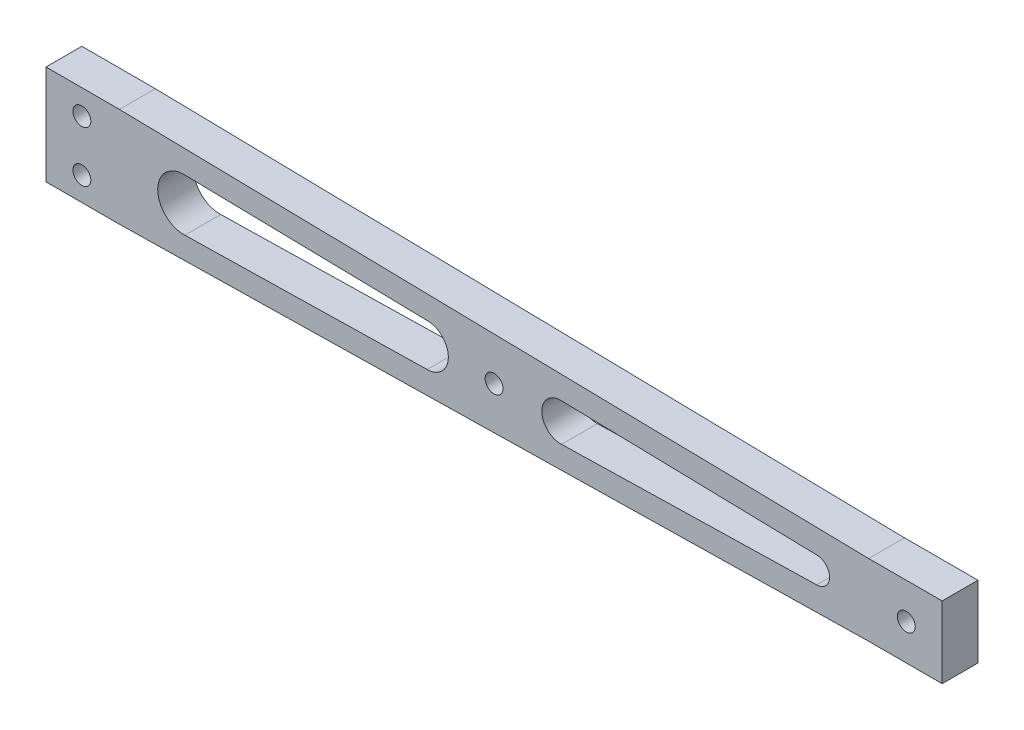
from build123d import *

# Parameters (mm, degrees)
MODEL_R                     = 2.5
DODANIE_WYCI_GNI_CIE1_DEPTH = 10


with BuildPart() as part:
    # Model → Dodanie-wyciągnięcie1 (new body)
    with BuildSketch(Plane.XY):
        Polygon((229.573669216, 20), (20.573669216, 24), (0.073669216, 24), (0.073669216, -3.757619404), (20.573669216, -3.757619404), (229.573669216, 0), (250.073669216, 0), (250.073669216, 20), align=None)
        with Locations((10.073669216, 17.121190298)):
            Circle(MODEL_R, mode=Mode.SUBTRACT)
        with Locations((240.073669216, 10)):
            Circle(MODEL_R, mode=Mode.SUBTRACT)
        with Locations((10.073669216, 2.878809702)):
            Circle(MODEL_R, mode=Mode.SUBTRACT)
        with Locations((125.073669216, 10)):
            Circle(MODEL_R, mode=Mode.SUBTRACT)
        with BuildLine():
            Line((215.057391591, 13.621190298), (143.897703929, 15.259018411))
            ThreePointArc((143.897703929, 15.259018411), (138.390896743, 10), (143.897703929, 4.740981589))
            Line((143.897703929, 4.740981589), (215.057391591, 6.378809702))
            ThreePointArc((215.057391591, 6.378809702), (218.678581889, 10), (215.057391591, 13.621190298))
        make_face(mode=Mode.SUBTRACT)
        with BuildLine():
            Line((106.398152108, 15.914510504), (38.806300427, 17.270637985))
            ThreePointArc((38.806300427, 17.270637985), (31.237940567, 10), (38.806300427, 2.729362015))
            Line((38.806300427, 2.729362015), (106.398152108, 4.085489496))
            ThreePointArc((106.398152108, 4.085489496), (112.312662612, 10), (106.398152108, 15.914510504))
        make_face(mode=Mode.SUBTRACT)
    extrude(amount=DODANIE_WYCI_GNI_CIE1_DEPTH)


solid = part.part
